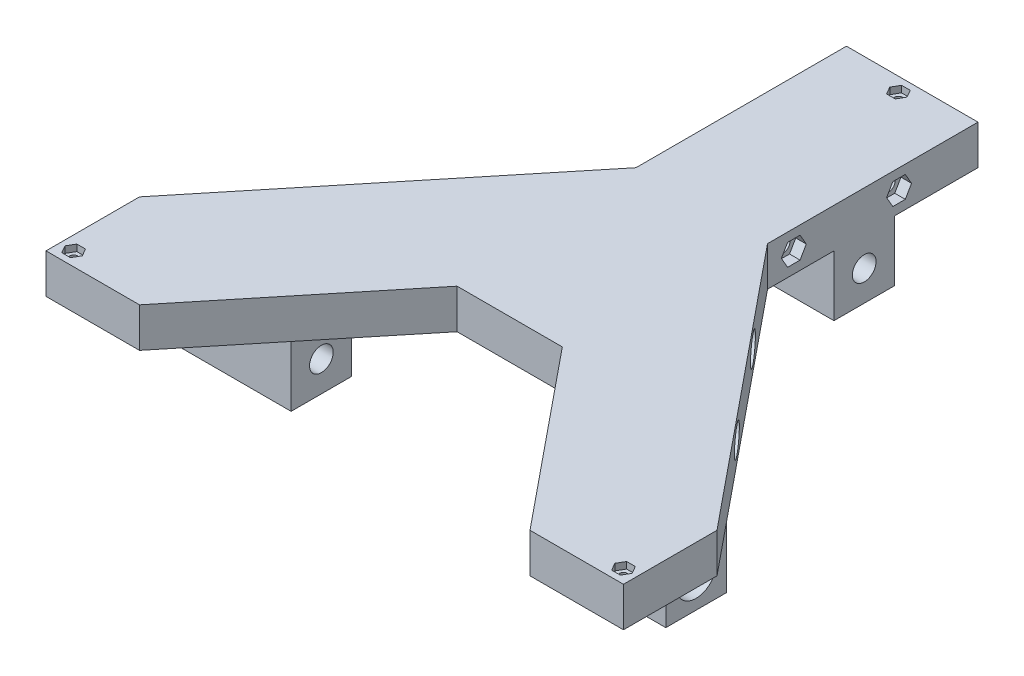
from build123d import *

# Parameters (mm, degrees)
BOSS_EXTRUDE1_DEPTH      = 15
SKETCH4_R                = 2.55
CUT_EXTRUDE1_DEPTH       = 311.78207799
CUT_EXTRUDE3_DEPTH       = 258.997698633
CUT_EXTRUDE3_DEPTH_BACK  = 3.5
SKETCH5_R                = 4.5
SKETCH6_R                = 5
CUT_EXTRUDE4_DEPTH       = 258.997698633
CUT_EXTRUDE5_DEPTH       = 4
SKETCH8_R                = 1.6
CUT_EXTRUDE6_DEPTH       = 246.866452571
CUT_EXTRUDE7_DEPTH       = 2.5
SKETCH10_W               = 50
SKETCH10_H               = 23
SKETCH10_W_2             = 45.759160871
BOSS_EXTRUDE2_DEPTH      = 23
CUT_EXTRUDE8_START       = -24
SKETCH11_R               = 7.6
CUT_EXTRUDE8_DEPTH       = 325.431928593
SKETCH12_R               = 4.5
CUT_EXTRUDE9_DEPTH       = 301.431928593
SKETCH13_R               = 4.5
CUT_EXTRUDE10_DEPTH      = 259.586180025
CUT_EXTRUDE11_DEPTH      = 12.5
CUT_EXTRUDE11_DEPTH_BACK = 12.5
SKETCH14_R               = 7.6


with BuildPart() as part:
    # Sketch1 → Boss-Extrude1 (new body)
    with BuildSketch(Plane(origin=(0, 0, 0), x_dir=(1, 0, 0), z_dir=(0, 1, 0))):
        Polygon((25, 0), (-25, 0), (-25, -80), (-109.75, -183.961915416), (-109.75, -219.5), (-74.211915416, -219.5), (-20, -152.998825191), (20, -152.998825191), (74.211915416, -219.5), (109.75, -219.5), (109.75, -183.961915416), (25, -80), align=None)
    extrude(amount=BOSS_EXTRUDE1_DEPTH)

    # Sketch4 → Cut-Extrude1 (cut, through all)
    with BuildSketch(Plane.ZY.offset(109.75)):
        with Locations((30, 7.5)):
            Circle(SKETCH4_R)
        with Locations((70, 7.5)):
            Circle(SKETCH4_R)
        with Locations((110, 7.5)):
            Circle(SKETCH4_R)
        with Locations((142.998825191, 7.5)):
            Circle(SKETCH4_R)
    extrude(amount=-CUT_EXTRUDE1_DEPTH, mode=Mode.SUBTRACT)

    # Sketch5 → Cut-Extrude3 (cut, two sides: drawn at the far end of the back side and taken through both)
    with BuildSketch(Plane.ZY.offset(25).offset(-CUT_EXTRUDE3_DEPTH_BACK)):
        with Locations(Location((30, 7.5, 0), (0, 0, 180))):
            Circle(SKETCH5_R)
        with Locations(Location((70, 7.5, 0), (0, 0, 180))):
            Circle(SKETCH5_R)
        with Locations(Location((110, 7.5, 0), (0, 0, 180))):
            Circle(SKETCH5_R)
        with Locations(Location((142.998825191, 7.5, 0), (0, 0, 180))):
            Circle(SKETCH5_R)
    extrude(amount=CUT_EXTRUDE3_DEPTH + CUT_EXTRUDE3_DEPTH_BACK, mode=Mode.SUBTRACT)

    # Sketch6 → Cut-Extrude4 (cut, through all)
    with BuildSketch(Plane(origin=(25, 0, 0), x_dir=(0, 0, -1), z_dir=(1, 0, 0))):
        with Locations((-142.998825191, 7.5)):
            Circle(SKETCH6_R)
        with Locations((-110, 7.5)):
            Circle(SKETCH6_R)
    extrude(amount=CUT_EXTRUDE4_DEPTH, mode=Mode.SUBTRACT)

    # Sketch7 → Cut-Extrude5 (cut)
    with BuildSketch(Plane(origin=(25, 0, 0), x_dir=(0, 0, -1), z_dir=(1, 0, 0))):
        Polygon((-34.734272207, 7.5), (-32.367136104, 3.4), (-27.632863896, 3.4), (-25.265727793, 7.5), (-27.632863896, 11.6), (-32.367136104, 11.6), align=None)
        Polygon((-74.734272207, 7.5), (-72.367136104, 3.4), (-67.632863896, 3.4), (-65.265727793, 7.5), (-67.632863896, 11.6), (-72.367136104, 11.6), align=None)
        Polygon((-114.734272207, 7.5), (-112.367136104, 3.4), (-107.632863896, 3.4), (-105.265727793, 7.5), (-107.632863896, 11.6), (-112.367136104, 11.6), align=None)
        Polygon((-147.733097398, 7.5), (-145.365961294, 3.4), (-140.631689087, 3.4), (-138.264552983, 7.5), (-140.631689087, 11.6), (-145.365961294, 11.6), align=None)
    extrude(amount=-CUT_EXTRUDE5_DEPTH, mode=Mode.SUBTRACT)

    # Sketch8 → Cut-Extrude6 (cut, through all)
    with BuildSketch(Plane(origin=(0, 15, 0), x_dir=(1, 0, 0), z_dir=(0, 1, 0))):
        with Locations(Location((0, -5.25, 0), (0, 0, 270))):
            Circle(SKETCH8_R)
        with Locations(Location((-104.5, -214.25, 0), (0, 0, 270))):
            Circle(SKETCH8_R)
        with Locations(Location((104.5, -214.25, 0), (0, 0, 270))):
            Circle(SKETCH8_R)
    extrude(amount=-CUT_EXTRUDE6_DEPTH, mode=Mode.SUBTRACT)

    # Sketch9 → Cut-Extrude7 (cut)
    with BuildSketch(Plane(origin=(0, 15, 0), x_dir=(1, 0, 0), z_dir=(0, 1, 0))):
        Polygon((-101.209103466, -214.25), (-102.854551733, -211.4), (-106.145448267, -211.4), (-107.790896534, -214.25), (-106.145448267, -217.1), (-102.854551733, -217.1), align=None)
        Polygon((101.209103466, -214.25), (102.854551733, -217.1), (106.145448267, -217.1), (107.790896534, -214.25), (106.145448267, -211.4), (102.854551733, -211.4), align=None)
        Polygon((3.290896534, -5.25), (1.645448267, -2.4), (-1.645448267, -2.4), (-3.290896534, -5.25), (-1.645448267, -8.1), (1.645448267, -8.1), align=None)
    extrude(amount=-CUT_EXTRUDE7_DEPTH, mode=Mode.SUBTRACT)

    # Sketch10 → Boss-Extrude2 (add)
    with BuildSketch(Plane.XZ):
        with Locations((0, 43.25)):
            Rectangle(SKETCH10_W, SKETCH10_H)
        with Locations((71.208820555, 176.25)):
            Rectangle(SKETCH10_W_2, SKETCH10_H)
        with Locations((-71.208820555, 176.25)):
            Rectangle(SKETCH10_W_2, SKETCH10_H)
    extrude(amount=BOSS_EXTRUDE2_DEPTH)

    # Sketch11 → Cut-Extrude8 (cut)
    with BuildSketch(Plane.ZY.offset(94.08840099).offset(CUT_EXTRUDE8_START)):
        with Locations(Location((176.25, -11.5, 0), (0, 0, 180))):
            Circle(SKETCH11_R)
    cut_extrude8 = extrude(amount=CUT_EXTRUDE8_DEPTH, mode=Mode.SUBTRACT)

    # Sketch12 → Cut-Extrude9 (cut, through all)
    with BuildSketch(Plane.ZY.offset(94.08840099)):
        with Locations((176.25, -11.5)):
            Circle(SKETCH12_R)
    extrude(amount=-CUT_EXTRUDE9_DEPTH, mode=Mode.SUBTRACT)

    # Mirror1: Cut-Extrude8 across plane
    add(cut_extrude8.mirror(Plane(origin=(0, 0, 0), x_dir=(0, 0, 1), z_dir=(1, 0, 0))), mode=Mode.SUBTRACT)

    # Sketch13 → Cut-Extrude10 (cut, through all)
    with BuildSketch(Plane.ZY.offset(25)):
        with Locations((43.25, -11.5)):
            Circle(SKETCH13_R)
    extrude(amount=-CUT_EXTRUDE10_DEPTH, mode=Mode.SUBTRACT)

    # Sketch14 → Cut-Extrude11 (cut, two sides: drawn at the far end of the back side and taken through both)
    with BuildSketch(Plane(origin=(0, 0, 0), x_dir=(0, 0, -1), z_dir=(1, 0, 0)).offset(-CUT_EXTRUDE11_DEPTH_BACK)):
        with Locations((-43.25, -11.5)):
            Circle(SKETCH14_R)
    extrude(amount=CUT_EXTRUDE11_DEPTH + CUT_EXTRUDE11_DEPTH_BACK, mode=Mode.SUBTRACT)


solid = part.part
